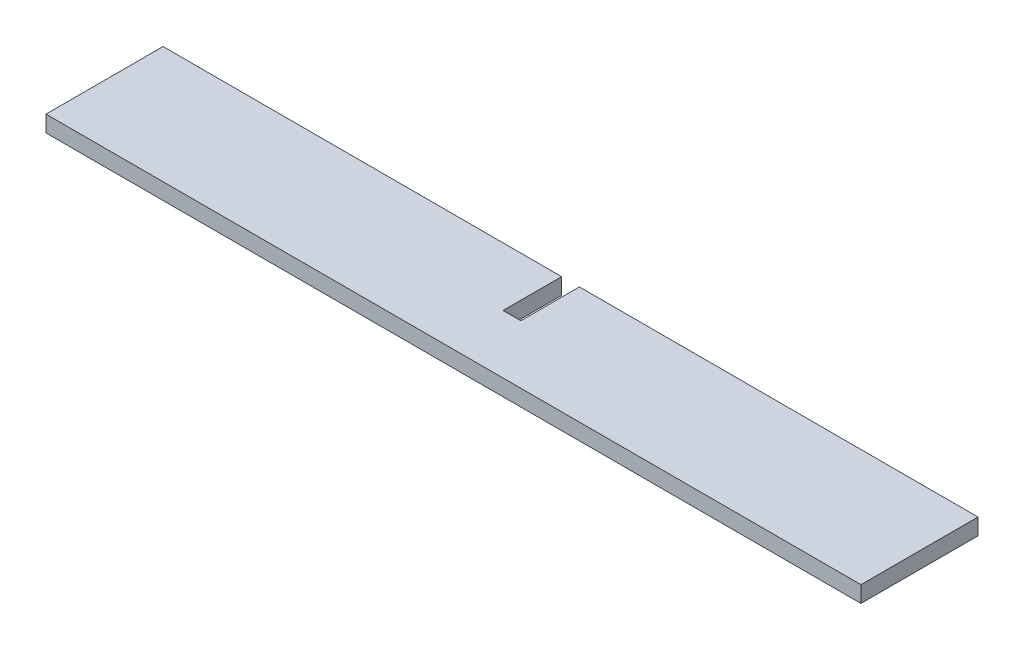
from build123d import *

# Parameters (mm, degrees)
BOSS_EXTRUDE1_DEPTH = 2.2


with BuildPart() as part:
    # Sketch1 → Boss-Extrude1 (new body)
    with BuildSketch(Plane(origin=(0, 0, 0), x_dir=(1, 0, 0), z_dir=(0, 1, 0))):
        Polygon((-12.229298369, 9.502287284), (-9.829298369, 9.502287284), (-9.829298369, 17.402287284), (43.970701631, 17.402287284), (43.970701631, 1.602287284), (-66.029298369, 1.602287284), (-66.029298369, 17.402287284), (-12.229298369, 17.402287284), align=None)
    extrude(amount=BOSS_EXTRUDE1_DEPTH)


solid = part.part
